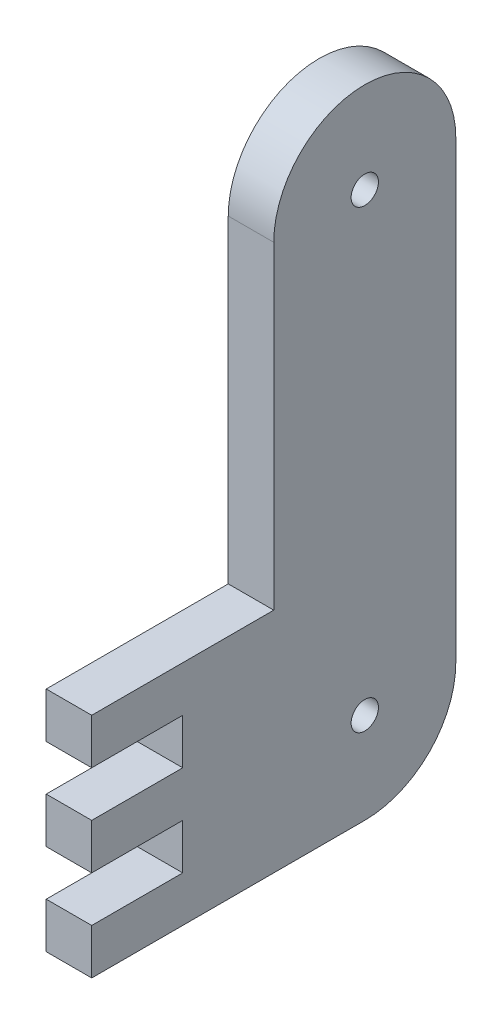
from build123d import *

# Parameters (mm, degrees)
SKETCH1_R           = 1.5
BOSS_EXTRUDE1_DEPTH = 5
SKETCH2_W           = 10
SKETCH2_H           = 5
CUT_EXTRUDE1_DEPTH  = 5


with BuildPart() as part:
    # Sketch1 → Boss-Extrude1 (new body)
    with BuildSketch(Plane(origin=(0, 0, 0), x_dir=(0, 0, -1), z_dir=(1, 0, 0))):
        with BuildLine():
            Line((-10, 15), (-30, 15))
            Line((-30, 15), (-30, -10))
            Line((-30, -10), (0, -10))
            ThreePointArc((0, -10), (7.071067812, -7.071067812), (10, 0))
            Line((10, 0), (10, 50))
            ThreePointArc((10, 50), (0, 60), (-10, 50))
            Line((-10, 50), (-10, 15))
        make_face()
        with Locations((0, 50)):
            Circle(SKETCH1_R, mode=Mode.SUBTRACT)
        Circle(SKETCH1_R, mode=Mode.SUBTRACT)
    extrude(amount=BOSS_EXTRUDE1_DEPTH)

    # Sketch2 → Cut-Extrude1 (cut)
    with BuildSketch(Plane(origin=(5, 0, 0), x_dir=(0, 0, -1), z_dir=(1, 0, 0))):
        with Locations((-25, 7.5)):
            Rectangle(SKETCH2_W, SKETCH2_H)
        with Locations((-25, -2.5)):
            Rectangle(SKETCH2_W, SKETCH2_H)
    extrude(amount=-CUT_EXTRUDE1_DEPTH, mode=Mode.SUBTRACT)


solid = part.part
